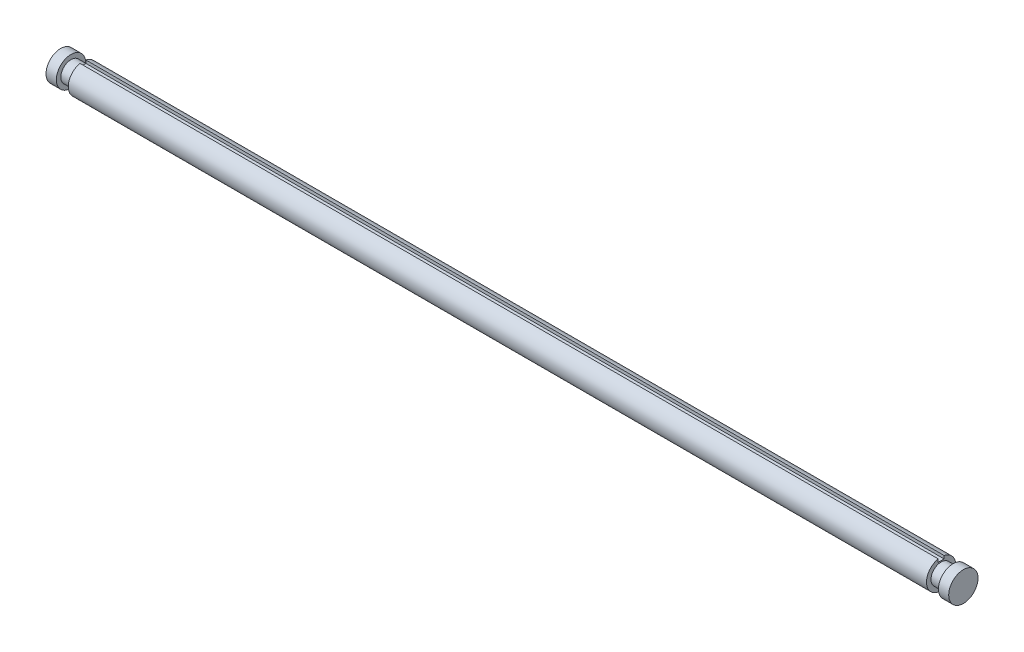
from build123d import *

# Parameters (mm, degrees)
CUT_EXTRUDE2_START = 48.1584
SKETCH2_W          = 63.4619
SKETCH2_H          = 12.7
CUT_EXTRUDE2_DEPTH = 1856.5622


with BuildPart() as part:
    # Sketch1 → Revolve1 (revolve)
    with BuildSketch(Plane(origin=(0, 0, 0), x_dir=(0, 1, 0), z_dir=(0, 0, 1)), mode=Mode.PRIVATE) as revolve1_sk:
        Polygon((0, 0), (31.73095, 0), (31.73095, -22.352), (22.0218, -22.352), (22.0218, -48.1584), (31.73095, -48.1584), (31.73095, -1904.7206), (22.0218, -1904.7206), (22.0218, -1930.527), (31.73095, -1930.527), (31.73095, -1952.752), (0, -1952.752), align=None)
    revolve(revolve1_sk.sketch.rotate(Axis((-25.4, 0, 0), (1, 0, 0)), 90), axis=Axis((-25.4, 0, 0), (1, 0, 0)))

    # Sketch2 → Cut-Extrude2 (cut)
    with BuildSketch(Plane.YZ.offset(CUT_EXTRUDE2_START)):
        with Locations((56.3372, 0)):
            Rectangle(SKETCH2_W, SKETCH2_H)
    extrude(amount=CUT_EXTRUDE2_DEPTH, mode=Mode.SUBTRACT)


solid = part.part
